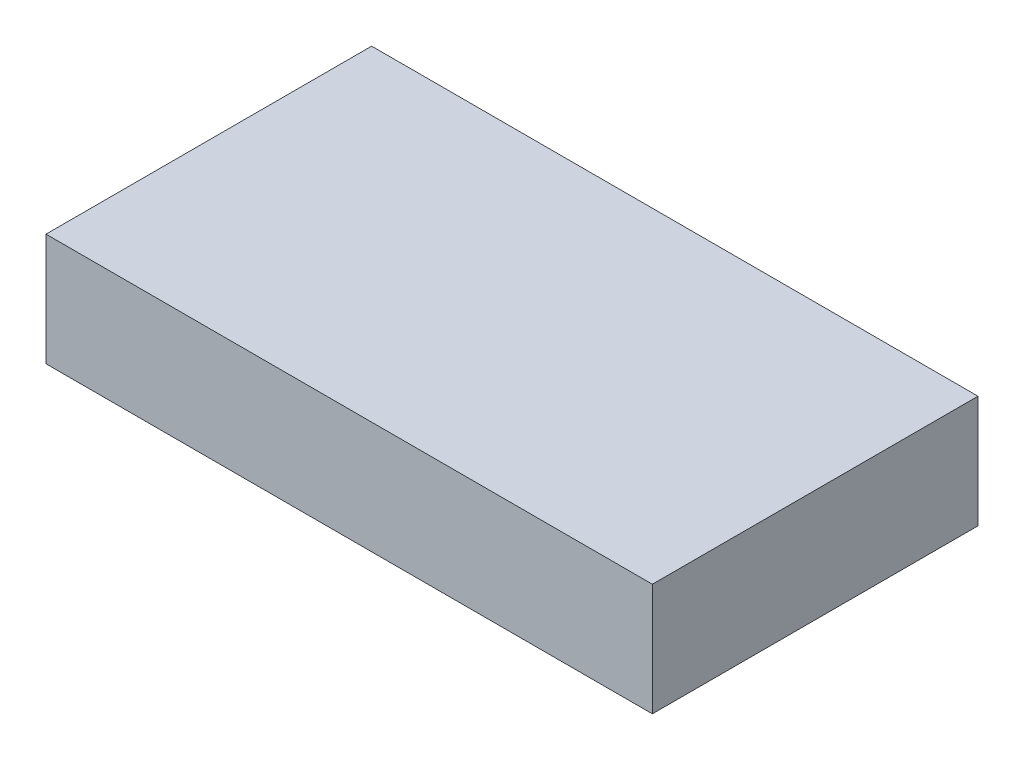
from build123d import *

# Parameters (mm, degrees)
SKETCH1_W           = 54
SKETCH1_H           = 29
BOSS_EXTRUDE1_DEPTH = 10


with BuildPart() as part:
    # Sketch1 → Boss-Extrude1 (new body)
    with BuildSketch(Plane(origin=(0, 0, 0), x_dir=(1, 0, 0), z_dir=(0, 1, 0))):
        Rectangle(SKETCH1_W, SKETCH1_H)
    extrude(amount=BOSS_EXTRUDE1_DEPTH)


solid = part.part
